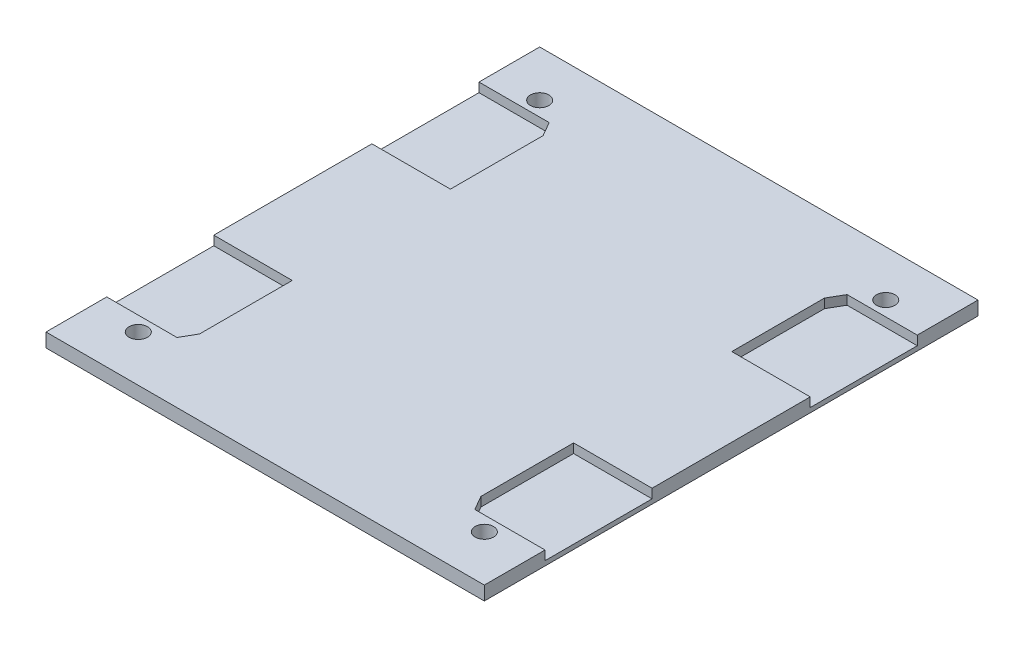
from build123d import *

# Parameters (mm, degrees)
SKETCH2_R           = 2
BOSS_EXTRUDE1_DEPTH = 3
CUT_EXTRUDE1_DEPTH  = 2


with BuildPart() as part:
    # Sketch2 → Boss-Extrude1 (new body)
    # profile 1 of 2: a face of its own
    with BuildSketch(Plane(origin=(0, 0, 0), x_dir=(1, 0, 0), z_dir=(0, 1, 0))):
        with BuildLine():
            ThreePointArc((37.5, -45.5), (36.085786438, -42.085786438), (39.5, -43.5))
            Line((39.5, -43.5), (47.5, -43.5))
            Line((47.5, -43.5), (47.5, 53.5))
            Line((47.5, 53.5), (-47.5, 53.5))
            Line((-47.5, 53.5), (-47.5, -53.5))
            Line((-47.5, -53.5), (37.5, -53.5))
            Line((37.5, -53.5), (37.5, -45.5))
        make_face()
        with Locations(Location((-37.5, -43.5, 0), (0, 0, 270))):
            Circle(SKETCH2_R, mode=Mode.SUBTRACT)
        with Locations(Location((-37.5, 43.5, 0), (0, 0, 270))):
            Circle(SKETCH2_R, mode=Mode.SUBTRACT)
        with Locations(Location((37.5, 43.5, 0), (0, 0, 270))):
            Circle(SKETCH2_R, mode=Mode.SUBTRACT)
    # profile 2 of 2: a face of its own
    with BuildSketch(Plane(origin=(0, 0, 0), x_dir=(1, 0, 0), z_dir=(0, 1, 0))):
        with BuildLine():
            Line((47.5, -43.5), (39.5, -43.5))
            ThreePointArc((39.5, -43.5), (38.914213562, -44.914213562), (37.5, -45.5))
            Line((37.5, -45.5), (37.5, -53.5))
            Line((37.5, -53.5), (47.5, -53.5))
            Line((47.5, -53.5), (47.5, -43.5))
        make_face()
    extrude(amount=BOSS_EXTRUDE1_DEPTH)

    # Sketch3 → Cut-Extrude1 (cut)
    with BuildSketch(Plane(origin=(0, 3, 0), x_dir=(1, 0, 0), z_dir=(0, 1, 0))):
        Polygon((-47.5, 40.237063088), (-47.5, 17.240159463), (-47.5, 17.140159463), (-30.489963443, 17.140159463), (-30.489963443, 37.232769094), (-32.282228416, 40.337063088), (-47.5, 40.337063088), align=None)
        Polygon((47.5, 40.337063088), (32.282228416, 40.337063088), (30.489963443, 37.232769094), (30.489963443, 17.140159463), (47.5, 17.140159463), (47.5, 17.240159463), (47.5, 40.237063088), align=None)
        Polygon((47.5, -17.240159463), (47.5, -17.140159463), (30.489963443, -17.140159463), (30.489963443, -37.232769094), (32.282228416, -40.337063088), (47.5, -40.337063088), (47.5, -40.237063088), align=None)
        Polygon((-30.489963443, -17.140159463), (-47.5, -17.140159463), (-47.5, -17.240159463), (-47.5, -40.237063088), (-47.5, -40.337063088), (-32.282228416, -40.337063088), (-30.489963443, -37.232769094), align=None)
    extrude(amount=-CUT_EXTRUDE1_DEPTH, mode=Mode.SUBTRACT)


solid = part.part
